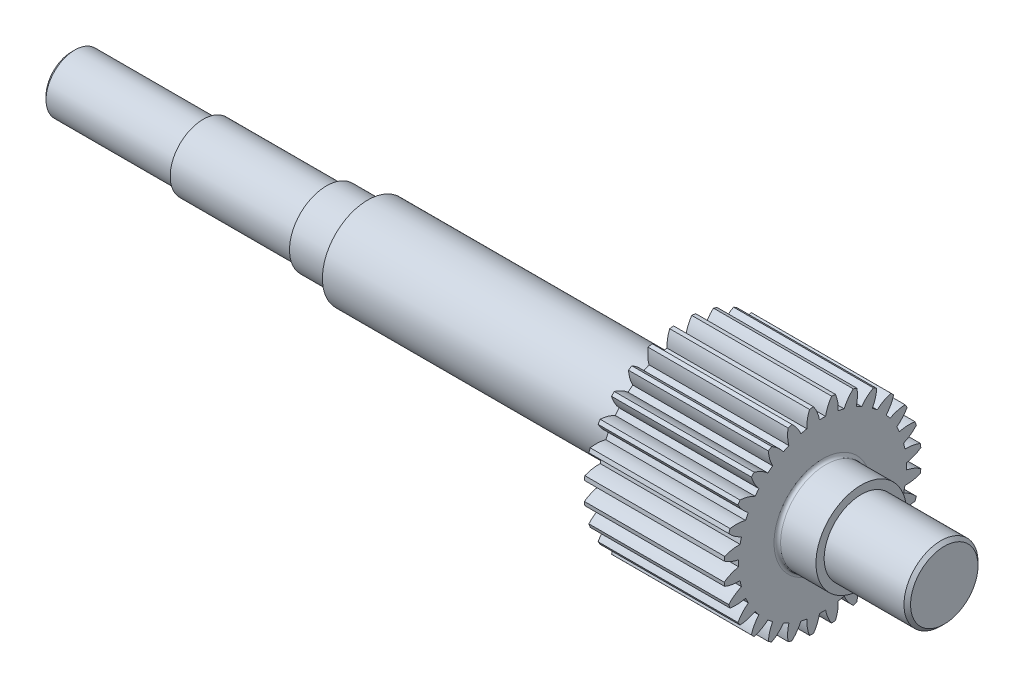
from build123d import *

# Parameters (mm, degrees)
BASPROSKE_W        = 85
BASPROSKE_H        = 60
TOOTHCUT_DEPTH     = 121.104121495
TEETHCUTS_COUNT    = 28
TEETHCUTS_ANGLE    = 347.142857143
BORSKE_R           = 0.4
BORE_DEPTH         = 85.0000508
FILLET1_R          = 2
CHAMFER1_SIZE      = 2
CUT_EXTRUDE1_DEPTH = 4.939


with BuildPart() as part:
    # BasProSke → Base-Revolve (revolve)
    with BuildSketch(Plane(origin=(0, 0, 0), x_dir=(1, 0, 0), z_dir=(0, 1, 0)), mode=Mode.PRIVATE) as base_revolve_sk:
        with Locations((42.5, 30)):
            Rectangle(BASPROSKE_W, BASPROSKE_H)
    revolve(base_revolve_sk.sketch.rotate(Axis((-10, 0, 0), (1, 0, 0)), 180), axis=Axis((-10, 0, 0), (1, 0, 0)))

    # TooCutSke → ToothCut (cut, through all)
    with BuildSketch(Plane(origin=(0, 0, 0), x_dir=(0, 0, -1), z_dir=(1, 0, 0))):
        with BuildLine():
            ThreePointArc((1.846027594, 50.965578414), (0, 50.999), (-1.846027594, 50.965578414))
            ThreePointArc((-1.846027594, 50.965578414), (-3.219400302, 55.566502749), (-5.541766648, 59.769034354))
            ThreePointArc((-5.541766648, 59.769034354), (0, 60.0254), (5.541766648, 59.769034354))
            ThreePointArc((5.541766648, 59.769034354), (3.219400302, 55.566502749), (1.846027594, 50.965578414))
        make_face()
    toothcut = extrude(amount=TOOTHCUT_DEPTH, mode=Mode.SUBTRACT)

    # TeethCuts: ToothCut ×28 about axis
    teethcuts_axis = Axis((-10, 0, 0), (1, 0, 0))
    for i in range(1, TEETHCUTS_COUNT):
        add(toothcut.rotate(teethcuts_axis, i * TEETHCUTS_ANGLE / (TEETHCUTS_COUNT - 1)), mode=Mode.SUBTRACT)

    # BorSke → Bore (cut, symmetric)
    with BuildSketch(Plane(origin=(0, 0, 0), x_dir=(0, 0, -1), z_dir=(1, 0, 0))):
        with Locations(Location((0, 0, 0), (0, 0, 180))):
            Circle(BORSKE_R)
    extrude(amount=BORE_DEPTH, both=True, mode=Mode.SUBTRACT)

    # Sketch1 → Revolve1 (revolve)
    with BuildSketch(Plane(origin=(0, 0, 0), x_dir=(1, 0, 0), z_dir=(0, 1, 0))):
        Polygon((159, 0), (159, 22.5), (108.5, 22.5), (108.5, 27.5), (-191.5, 27.5), (-191.5, 22.5), (-216.5, 22.5), (-216.5, 20), (-291.5, 20), (-291.5, 17.5), (-371.5, 17.5), (-371.5, 0), align=None)
    revolve(axis=Axis((159, 0, 0), (-1, 0, 0)))

    # Fillet1
    fillet1_edges = [part.edges().sort_by_distance(p)[0] for p in [
        (85, 0, 27.5),
        (0, 0, 27.5),
    ]]
    fillet(fillet1_edges, radius=FILLET1_R)

    # Chamfer1
    chamfer1_edges = [part.edges().sort_by_distance(p)[0] for p in [
        (159, 0, 22.5),
        (-371.5, 0, 17.5),
    ]]
    chamfer(chamfer1_edges, length=CHAMFER1_SIZE)

    # Sketch2 → Cut-Extrude1 (cut)
    with BuildSketch(Plane(origin=(0, 0, -17.5), x_dir=(-1, 0, 0), z_dir=(0, 0, -1))):
        with BuildLine():
            Line((327.5, 6), (415.5, 6))
            ThreePointArc((415.5, 6), (421.5, 0), (415.5, -6))
            Line((415.5, -6), (327.5, -6))
            ThreePointArc((327.5, -6), (321.5, 0), (327.5, 6))
        make_face()
    extrude(amount=-CUT_EXTRUDE1_DEPTH, mode=Mode.SUBTRACT)


solid = part.part
